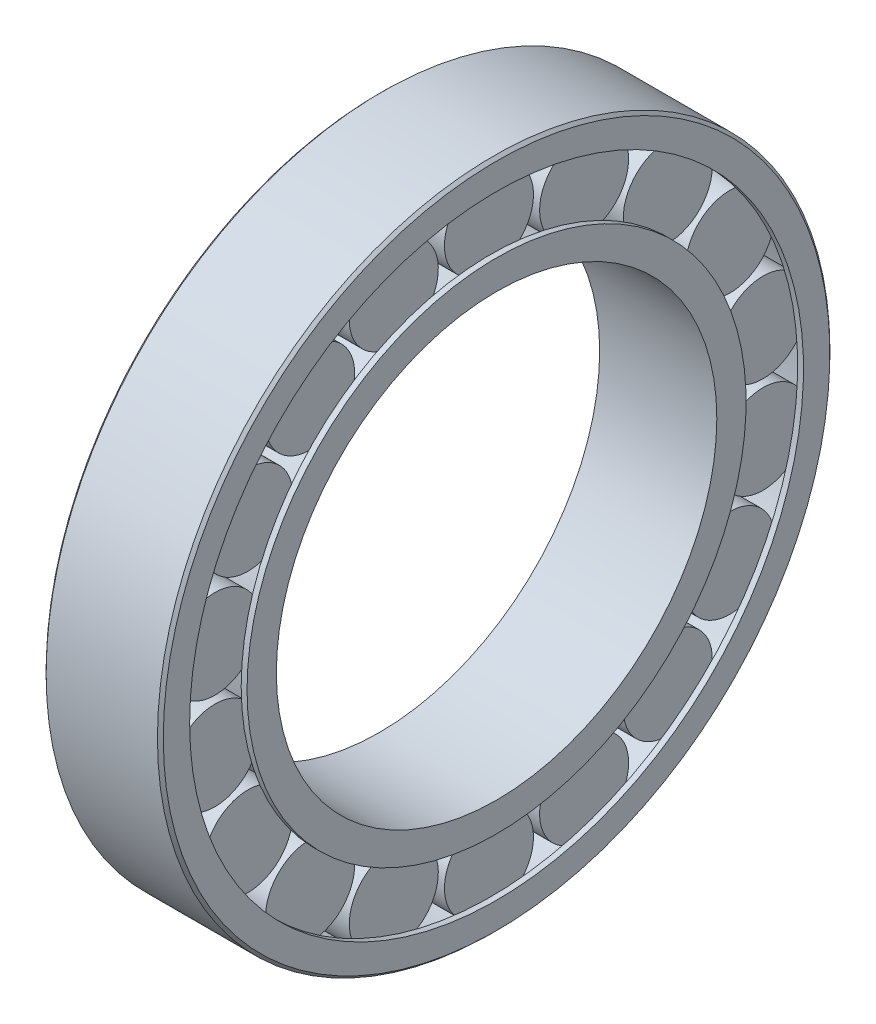
from build123d import *

# Parameters (mm, degrees)
SKETCH_2_W               = 17.4
SKETCH_2_H               = 7.6
PATTERN_CIRCULAR_2_COUNT = 18
CHAMFER_1_SIZE           = 0.5


with BuildPart() as part:
    # 草图1 → 旋转1 (revolve)
    with BuildSketch(Plane.XY, mode=Mode.PRIVATE) as revolve_1_sk:
        Polygon((-10, 57.4), (10, 57.4), (10, 52.4), (9, 52.4), (9, 55.4), (-9, 55.4), (-9, 52.4), (-10, 52.4), align=None)
        Polygon((-10, 37.6), (10, 37.6), (10, 42.6), (9, 42.6), (9, 39.6), (-9, 39.6), (-9, 42.6), (-10, 42.6), align=None)
    revolve(revolve_1_sk.sketch.rotate(Axis((0, 0, 0), (1, 0, 0)), 90), axis=Axis((0, 0, 0), (1, 0, 0)))

    # 倒角1
    chamfer_1_edges = [part.edges().sort_by_distance(p)[0] for p in [
        (-10, 0, -57.4),
        (10, 0, -57.4),
    ]]
    chamfer(chamfer_1_edges, length=CHAMFER_1_SIZE)


with BuildPart() as body_2:
    # 草图2 → 旋转2 (revolve)
    with BuildSketch(Plane.XY, mode=Mode.PRIVATE) as revolve_2_sk:
        with Locations((0, 51.3)):
            Rectangle(SKETCH_2_W, SKETCH_2_H)
    revolve(revolve_2_sk.sketch.rotate(Axis((-8.7, 47.5, 0), (1, 0, 0)), 90), axis=Axis((-8.7, 47.5, 0), (1, 0, 0)))


with BuildPart() as pattern_circular_2_1:
    # 阵列(圆周)2: pattern copy
    add(body_2.part.rotate(Axis((0, 0, 0), (1, 0, 0)), 1 * 360 / PATTERN_CIRCULAR_2_COUNT))


with BuildPart() as pattern_circular_2_2:
    # 阵列(圆周)2: pattern copy
    add(body_2.part.rotate(Axis((0, 0, 0), (1, 0, 0)), 2 * 360 / PATTERN_CIRCULAR_2_COUNT))


with BuildPart() as pattern_circular_2_3:
    # 阵列(圆周)2: pattern copy
    add(body_2.part.rotate(Axis((0, 0, 0), (1, 0, 0)), 3 * 360 / PATTERN_CIRCULAR_2_COUNT))


with BuildPart() as pattern_circular_2_4:
    # 阵列(圆周)2: pattern copy
    add(body_2.part.rotate(Axis((0, 0, 0), (1, 0, 0)), 4 * 360 / PATTERN_CIRCULAR_2_COUNT))


with BuildPart() as pattern_circular_2_5:
    # 阵列(圆周)2: pattern copy
    add(body_2.part.rotate(Axis((0, 0, 0), (1, 0, 0)), 5 * 360 / PATTERN_CIRCULAR_2_COUNT))


with BuildPart() as pattern_circular_2_6:
    # 阵列(圆周)2: pattern copy
    add(body_2.part.rotate(Axis((0, 0, 0), (1, 0, 0)), 6 * 360 / PATTERN_CIRCULAR_2_COUNT))


with BuildPart() as pattern_circular_2_7:
    # 阵列(圆周)2: pattern copy
    add(body_2.part.rotate(Axis((0, 0, 0), (1, 0, 0)), 7 * 360 / PATTERN_CIRCULAR_2_COUNT))


with BuildPart() as pattern_circular_2_8:
    # 阵列(圆周)2: pattern copy
    add(body_2.part.rotate(Axis((0, 0, 0), (1, 0, 0)), 8 * 360 / PATTERN_CIRCULAR_2_COUNT))


with BuildPart() as pattern_circular_2_9:
    # 阵列(圆周)2: pattern copy
    add(body_2.part.rotate(Axis((0, 0, 0), (1, 0, 0)), 9 * 360 / PATTERN_CIRCULAR_2_COUNT))


with BuildPart() as pattern_circular_2_10:
    # 阵列(圆周)2: pattern copy
    add(body_2.part.rotate(Axis((0, 0, 0), (1, 0, 0)), 10 * 360 / PATTERN_CIRCULAR_2_COUNT))


with BuildPart() as pattern_circular_2_11:
    # 阵列(圆周)2: pattern copy
    add(body_2.part.rotate(Axis((0, 0, 0), (1, 0, 0)), 11 * 360 / PATTERN_CIRCULAR_2_COUNT))


with BuildPart() as pattern_circular_2_12:
    # 阵列(圆周)2: pattern copy
    add(body_2.part.rotate(Axis((0, 0, 0), (1, 0, 0)), 12 * 360 / PATTERN_CIRCULAR_2_COUNT))


with BuildPart() as pattern_circular_2_13:
    # 阵列(圆周)2: pattern copy
    add(body_2.part.rotate(Axis((0, 0, 0), (1, 0, 0)), 13 * 360 / PATTERN_CIRCULAR_2_COUNT))


with BuildPart() as pattern_circular_2_14:
    # 阵列(圆周)2: pattern copy
    add(body_2.part.rotate(Axis((0, 0, 0), (1, 0, 0)), 14 * 360 / PATTERN_CIRCULAR_2_COUNT))


with BuildPart() as pattern_circular_2_15:
    # 阵列(圆周)2: pattern copy
    add(body_2.part.rotate(Axis((0, 0, 0), (1, 0, 0)), 15 * 360 / PATTERN_CIRCULAR_2_COUNT))


with BuildPart() as pattern_circular_2_16:
    # 阵列(圆周)2: pattern copy
    add(body_2.part.rotate(Axis((0, 0, 0), (1, 0, 0)), 16 * 360 / PATTERN_CIRCULAR_2_COUNT))


with BuildPart() as pattern_circular_2_17:
    # 阵列(圆周)2: pattern copy
    add(body_2.part.rotate(Axis((0, 0, 0), (1, 0, 0)), 17 * 360 / PATTERN_CIRCULAR_2_COUNT))


solid = Compound([part.part, body_2.part, pattern_circular_2_1.part, pattern_circular_2_2.part, pattern_circular_2_3.part, pattern_circular_2_4.part, pattern_circular_2_5.part, pattern_circular_2_6.part, pattern_circular_2_7.part, pattern_circular_2_8.part, pattern_circular_2_9.part, pattern_circular_2_10.part, pattern_circular_2_11.part, pattern_circular_2_12.part, pattern_circular_2_13.part, pattern_circular_2_14.part, pattern_circular_2_15.part, pattern_circular_2_16.part, pattern_circular_2_17.part])
